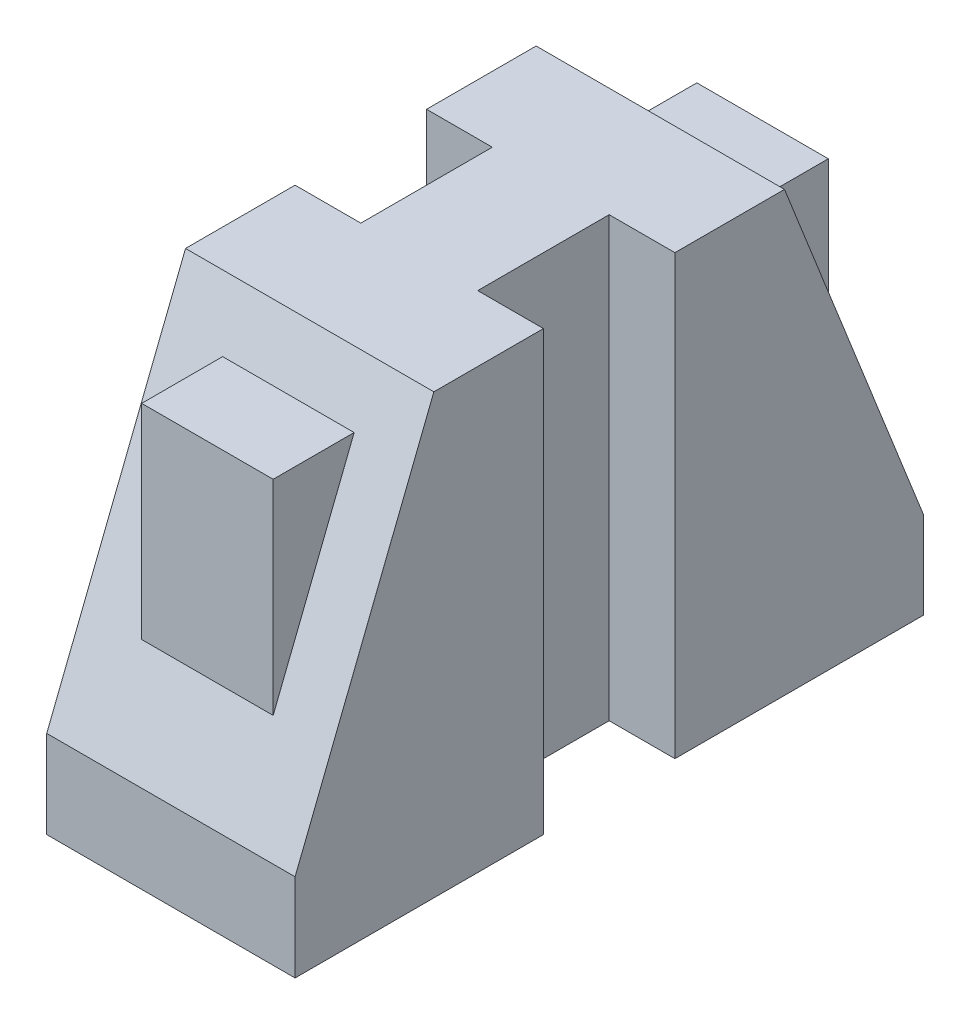
from build123d import *

# Parameters (mm, degrees)
SALIENTE_EXTRUIR2_DEPTH = 17
CROQUIS2_W              = 9
CROQUIS2_H              = 18
CORTAR_EXTRUIR1_DEPTH   = 76.749587458
SALIENTE_EXTRUIR3_DEPTH = 9


with BuildPart() as part:
    # Croquis1 → Saliente-Extruir2 (new, symmetric)
    with BuildSketch(Plane(origin=(0, 0, 0), x_dir=(0, 0, -1), z_dir=(1, 0, 0))):
        Polygon((43, 0), (-43, 0), (-43, 12), (-24, 60), (24, 60), (43, 12), align=None)
    extrude(amount=SALIENTE_EXTRUIR2_DEPTH, both=True)

    # Croquis2 → Cortar-Extruir1 (cut, through all)
    with BuildSketch(Plane(origin=(0, 60, 0), x_dir=(1, 0, 0), z_dir=(0, 1, 0))):
        with Locations((12.5, 0)):
            Rectangle(CROQUIS2_W, CROQUIS2_H)
        with Locations((-12.5, 0)):
            Rectangle(CROQUIS2_W, CROQUIS2_H)
    extrude(amount=-CORTAR_EXTRUIR1_DEPTH, mode=Mode.SUBTRACT)

    # Croquis3 → Saliente-Extruir3 (add, symmetric)
    with BuildSketch(Plane(origin=(0, 0, 0), x_dir=(0, 0, -1), z_dir=(1, 0, 0))):
        Polygon((-38, 24.631578947), (-38, 52.631578947), (-26.916666667, 52.631578947), align=None)
        Polygon((26.916666667, 52.631578947), (38, 24.631578947), (38, 52.631578947), align=None)
    extrude(amount=SALIENTE_EXTRUIR3_DEPTH, both=True)


solid = part.part
